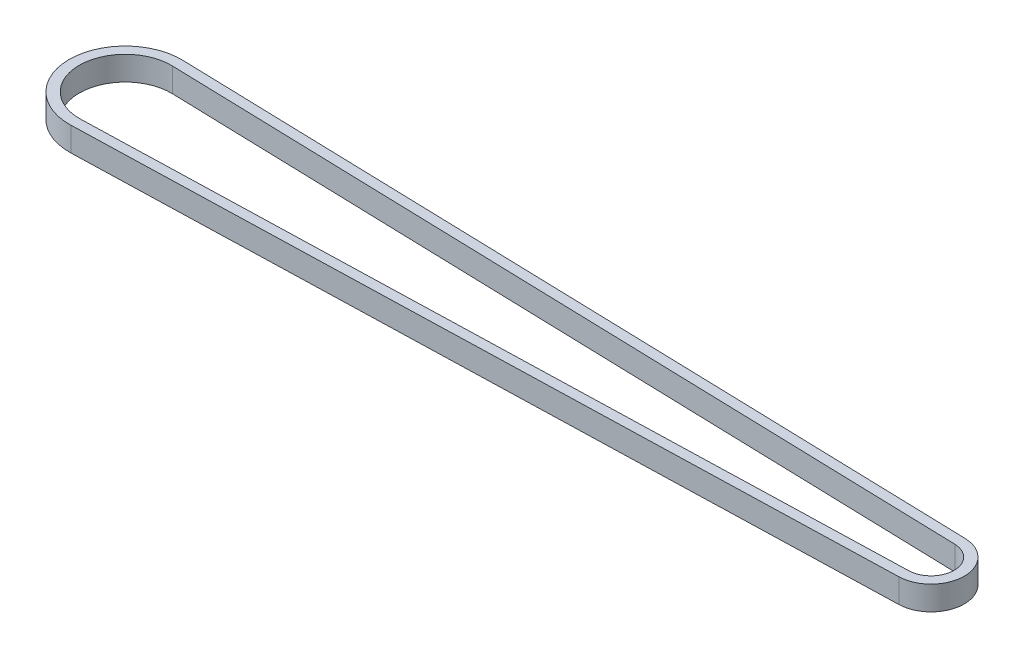
from build123d import *

# Parameters (mm, degrees)
BOSS_EXTRUDE1_DEPTH = 5.9944


with BuildPart() as part:
    # Sketch1 → Boss-Extrude1 (new body)
    with BuildSketch(Plane(origin=(0, 0, 0), x_dir=(1, 0, 0), z_dir=(0, 1, 0))):
        with BuildLine():
            Line((-99.932120253, 13.964332841), (100.565110759, 8.251651224))
            ThreePointArc((100.565110759, 8.251651224), (108.585, 0), (100.565110759, -8.251651224))
            Line((100.565110759, -8.251651224), (-99.932120253, -13.964332841))
            ThreePointArc((-99.932120253, -13.964332841), (-114.3, 0), (-99.932120253, 13.964332841))
        make_face()
        with BuildLine():
            Line((-100.003086085, 11.450734319), (100.493493201, 5.726636642))
            ThreePointArc((100.493493201, 5.726636642), (106.05897, 0), (100.493493201, -5.726636642))
            Line((100.493493201, -5.726636642), (-100.003086085, -11.450734319))
            ThreePointArc((-100.003086085, -11.450734319), (-111.7854, 0), (-100.003086085, 11.450734319))
        make_face(mode=Mode.SUBTRACT)
    extrude(amount=BOSS_EXTRUDE1_DEPTH)


solid = part.part
